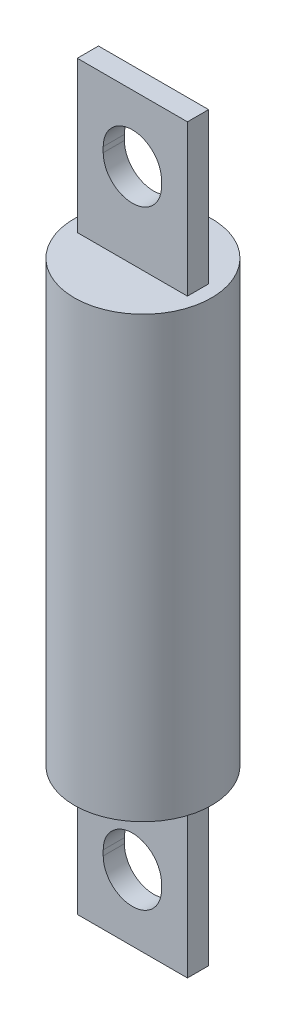
from build123d import *

# Parameters (mm, degrees)
SKETCH1_R           = 10.287
BOSS_EXTRUDE1_DEPTH = 65.8876
SKETCH2_W           = 16.51
SKETCH2_H           = 3.175
BOSS_EXTRUDE2_DEPTH = 22.6314
CUT_EXTRUDE1_DEPTH  = 90.902388624


with BuildPart() as part:
    # Sketch1 → Boss-Extrude1 (new body)
    with BuildSketch(Plane(origin=(0, 0, 0), x_dir=(1, 0, 0), z_dir=(0, 1, 0))):
        with Locations(Location((0, 0, 0), (0, 0, 270))):
            Circle(SKETCH1_R)
    extrude(amount=BOSS_EXTRUDE1_DEPTH)

    # Sketch2 → Boss-Extrude2 (add)
    with BuildSketch(Plane(origin=(0, 65.8876, 0), x_dir=(1, 0, 0), z_dir=(0, 1, 0))):
        Rectangle(SKETCH2_W, SKETCH2_H)
    boss_extrude2 = extrude(amount=BOSS_EXTRUDE2_DEPTH)

    # Sketch3 → Cut-Extrude1 (cut, through all)
    with BuildSketch(Plane.XY.offset(1.5875)):
        with BuildLine():
            Line((-4.3688, 78.98511), (-4.3688, 78.1939))
            ThreePointArc((-4.3688, 78.1939), (0, 73.8251), (4.3688, 78.1939))
            Line((4.3688, 78.1939), (4.3688, 78.98511))
            ThreePointArc((4.3688, 78.98511), (0, 83.35391), (-4.3688, 78.98511))
        make_face()
    cut_extrude1 = extrude(amount=-CUT_EXTRUDE1_DEPTH, mode=Mode.SUBTRACT)

    # Mirror2: Boss-Extrude2, Cut-Extrude1 across plane
    add(boss_extrude2.mirror(Plane.ZX.offset(32.9438)))
    add(cut_extrude1.mirror(Plane.ZX.offset(32.9438)), mode=Mode.SUBTRACT)


solid = part.part
